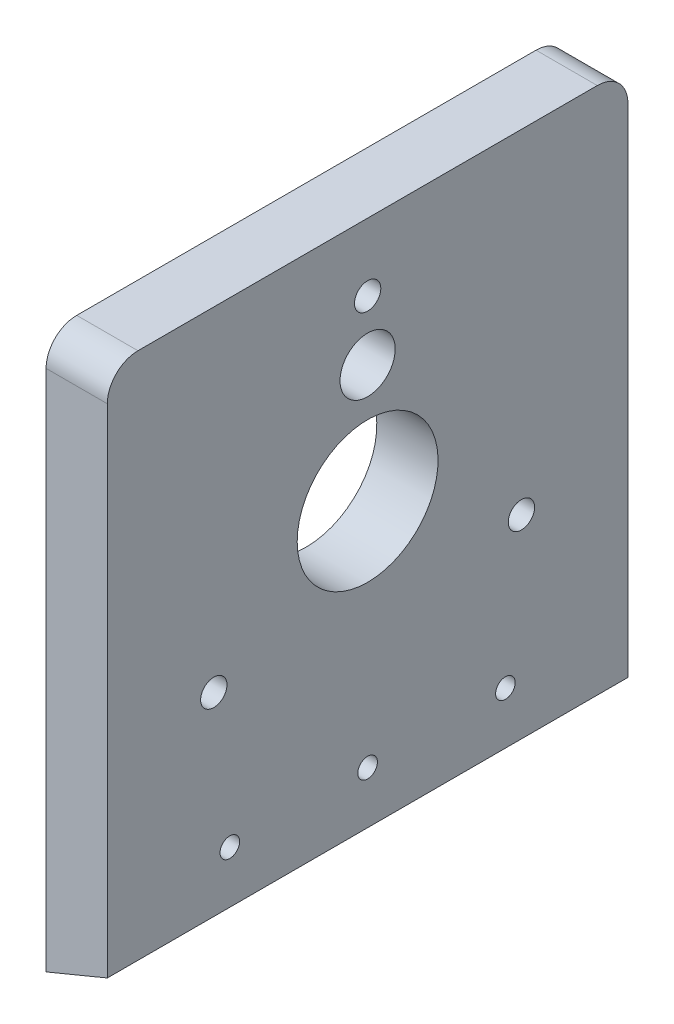
from build123d import *

# Parameters (mm, degrees)
BOSS_EXTRUDE1_DEPTH = 85
SKETCH3_R           = 11.5
SKETCH3_R_2         = 4.5
SKETCH3_R_3         = 2.15
CUT_EXTRUDE1_DEPTH  = 85
SKETCH4_R           = 1.6
CUT_EXTRUDE2_DEPTH  = 85
FILLET1_R           = 5


with BuildPart() as part:
    # Sketch2 → Boss-Extrude1 (new body)
    with BuildSketch(Plane.XY):
        Polygon((0, 0), (0, 86.2), (-10, 86.2), (-10, -4.142135624), align=None)
    extrude(amount=BOSS_EXTRUDE1_DEPTH)

    # Sketch3 → Cut-Extrude1 (cut)
    with BuildSketch(Plane.ZY.offset(10)):
        with Locations(Location((42.5, 46.2, 0), (0, 0, 270))):
            Circle(SKETCH3_R)
        with Locations(Location((42.5, 65.45, 0), (0, 0, 270))):
            Circle(SKETCH3_R_2)
        with Locations(Location((42.5, 75.2, 0), (0, 0, 270))):
            Circle(SKETCH3_R_3)
        with Locations(Location((67.61473671, 31.7, 0), (0, 0, 270))):
            Circle(SKETCH3_R_3)
        with Locations(Location((17.38526329, 31.7, 0), (0, 0, 270))):
            Circle(SKETCH3_R_3)
    extrude(amount=-CUT_EXTRUDE1_DEPTH, mode=Mode.SUBTRACT)

    # Sketch4 → Cut-Extrude2 (cut)
    with BuildSketch(Plane(origin=(0, 0, 0), x_dir=(0, 0, -1), z_dir=(1, 0, 0))):
        with Locations((-65, 8.5)):
            Circle(SKETCH4_R)
        with Locations((-20, 8.5)):
            Circle(SKETCH4_R)
        with Locations((-42.5, 8.5)):
            Circle(SKETCH4_R)
    extrude(amount=-CUT_EXTRUDE2_DEPTH, mode=Mode.SUBTRACT)

    # Fillet1
    fillet1_edges = [part.edges().sort_by_distance(p)[0] for p in [
        (-5, 86.2, 85),
        (-5, 86.2, 0),
    ]]
    fillet(fillet1_edges, radius=FILLET1_R)


solid = part.part
